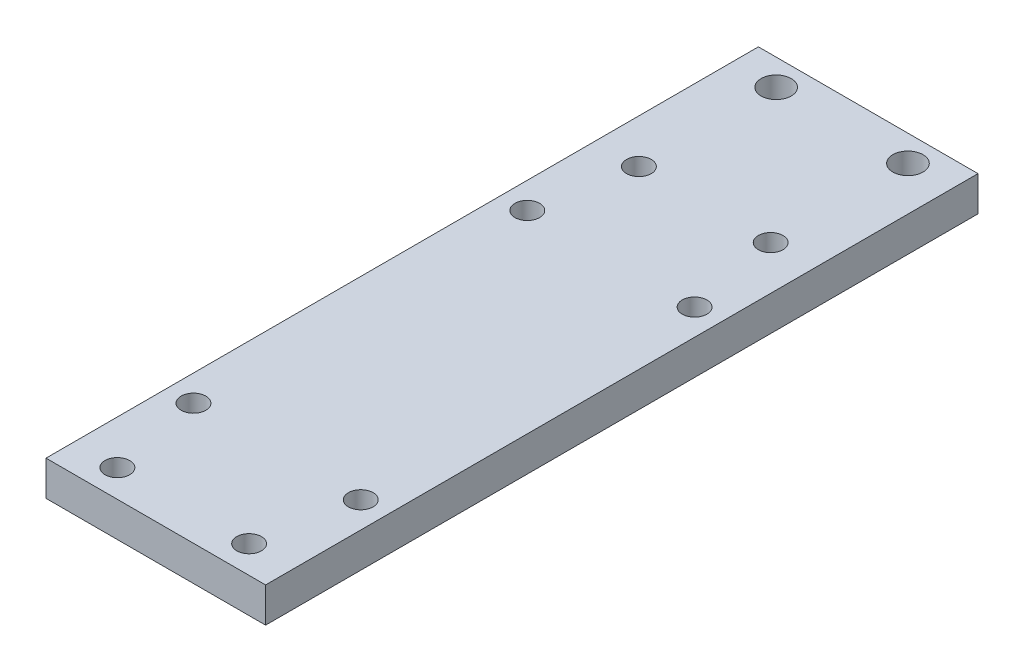
from build123d import *

# Parameters (mm, degrees)
SKETCH1_W               = 40
SKETCH1_H               = 160
BOSS_EXTRUDE1_DEPTH     = 3.175
M4_5_THROUGH_DEPTH      = 6.35
M4_5_THROUGH_DEPTH_BACK = 3.175
SKETCH3_R               = 2.75
SKETCH3_R_2             = 2.25
SKETCH4_R               = 1.5
M3_DRILL_DEPTH          = 8
SKETCH5_R               = 2.25
M4_THROUGH_DEPTH        = 6.35
SKETCH6_W               = 40
SKETCH6_H               = 30.2375
CUT_EXTRUDE1_DEPTH      = 6.35


with BuildPart() as part:
    # Sketch1 → Boss-Extrude1 (new, symmetric)
    with BuildSketch(Plane(origin=(0, 0, 0), x_dir=(1, 0, 0), z_dir=(0, 1, 0))):
        Rectangle(SKETCH1_W, SKETCH1_H)
    extrude(amount=BOSS_EXTRUDE1_DEPTH, both=True)

    # Sketch3 → M4/5_through (cut, two sides: drawn at the far end of the back side and taken through both)
    with BuildSketch(Plane(origin=(0, 0, 0), x_dir=(1, 0, 0), z_dir=(0, 1, 0)).offset(-M4_5_THROUGH_DEPTH_BACK)):
        with Locations(Location((12, 75.2375, 0), (0, 0, 270))):
            Circle(SKETCH3_R)
        with Locations(Location((12, 50.2375, 0), (0, 0, 270))):
            Circle(SKETCH3_R_2)
        with Locations(Location((-12, 50.2375, 0), (0, 0, 270))):
            Circle(SKETCH3_R_2)
        with Locations(Location((-12, 75.2375, 0), (0, 0, 270))):
            Circle(SKETCH3_R)
        with Locations(Location((-12, -44.7625, 0), (0, 0, 270))):
            Circle(SKETCH3_R_2)
        with Locations(Location((12, -44.7625, 0), (0, 0, 270))):
            Circle(SKETCH3_R_2)
    extrude(amount=M4_5_THROUGH_DEPTH + M4_5_THROUGH_DEPTH_BACK, mode=Mode.SUBTRACT)

    # Sketch4 → M3_DRILL (cut)
    with BuildSketch(Plane(origin=(0, 0, -80), x_dir=(-1, 0, 0), z_dir=(0, 0, -1))):
        Circle(SKETCH4_R)
    extrude(amount=-M3_DRILL_DEPTH, mode=Mode.SUBTRACT)

    # Sketch5 → M4_through (cut)
    with BuildSketch(Plane(origin=(0, 3.175, 0), x_dir=(1, 0, 0), z_dir=(0, 1, 0))):
        with Locations(Location((-15.2375, -27.6625, 0), (0, 0, 270))):
            Circle(SKETCH5_R)
        with Locations(Location((15.2375, -27.6625, 0), (0, 0, 270))):
            Circle(SKETCH5_R)
        with Locations(Location((15.2375, 33.1375, 0), (0, 0, 270))):
            Circle(SKETCH5_R)
        with Locations(Location((-15.2375, 33.1375, 0), (0, 0, 270))):
            Circle(SKETCH5_R)
    extrude(amount=-M4_THROUGH_DEPTH, mode=Mode.SUBTRACT)

    # Sketch6 → Cut-Extrude1 (cut)
    with BuildSketch(Plane(origin=(0, 3.175, 0), x_dir=(1, 0, 0), z_dir=(0, 1, 0))):
        with Locations((0, -64.88125)):
            Rectangle(SKETCH6_W, SKETCH6_H)
    extrude(amount=-CUT_EXTRUDE1_DEPTH, mode=Mode.SUBTRACT)


solid = part.part
